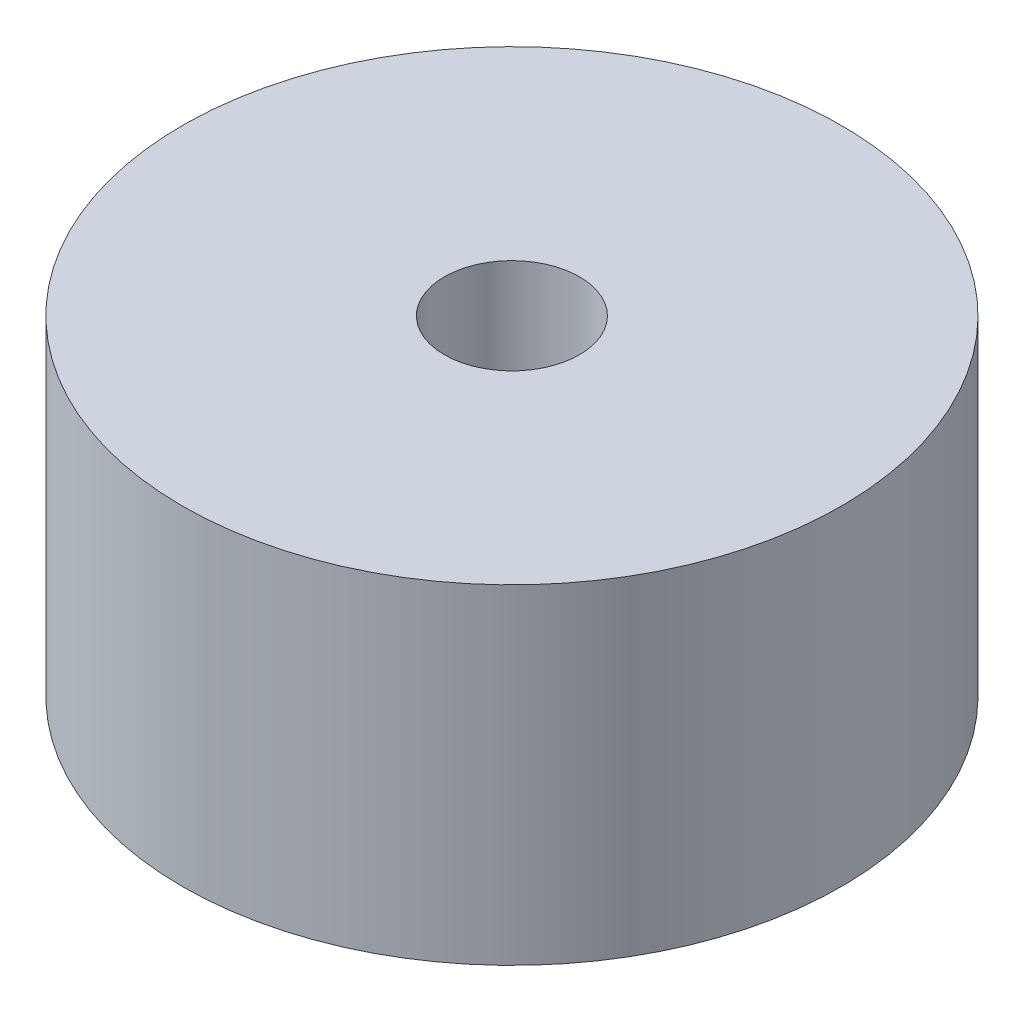
from build123d import *

# Parameters (mm, degrees)
SKETCH1_R                    = 5
BOSS_EXTRUDE1_DEPTH          = 5
M2_5X0_45_TAPPED_HOLE1_D     = 2.05
M2_5X0_45_TAPPED_HOLE1_DEPTH = 7.25
M2_5X0_45_TAPPED_HOLE1_TIP   = 0.615882135


with BuildPart() as part:
    # Sketch1 → Boss-Extrude1 (new body)
    with BuildSketch(Plane(origin=(0, 0, 0), x_dir=(1, 0, 0), z_dir=(0, 1, 0))):
        with Locations(Location((0, 0, 0), (0, 0, 270))):
            Circle(SKETCH1_R)
    extrude(amount=BOSS_EXTRUDE1_DEPTH)

    # M2.5x0.45 Tapped Hole1
    with Locations(Plane(origin=(0, 5, 0), x_dir=(1, 0, 0), z_dir=(0, 1, 0))):
        with Locations((0, 0)):
            Hole(M2_5X0_45_TAPPED_HOLE1_D / 2, depth=M2_5X0_45_TAPPED_HOLE1_DEPTH)
            with Locations((0, 0, -(M2_5X0_45_TAPPED_HOLE1_DEPTH + M2_5X0_45_TAPPED_HOLE1_TIP / 2))):  # 118° drill point
                Cone(0, M2_5X0_45_TAPPED_HOLE1_D / 2, M2_5X0_45_TAPPED_HOLE1_TIP, mode=Mode.SUBTRACT)


solid = part.part
